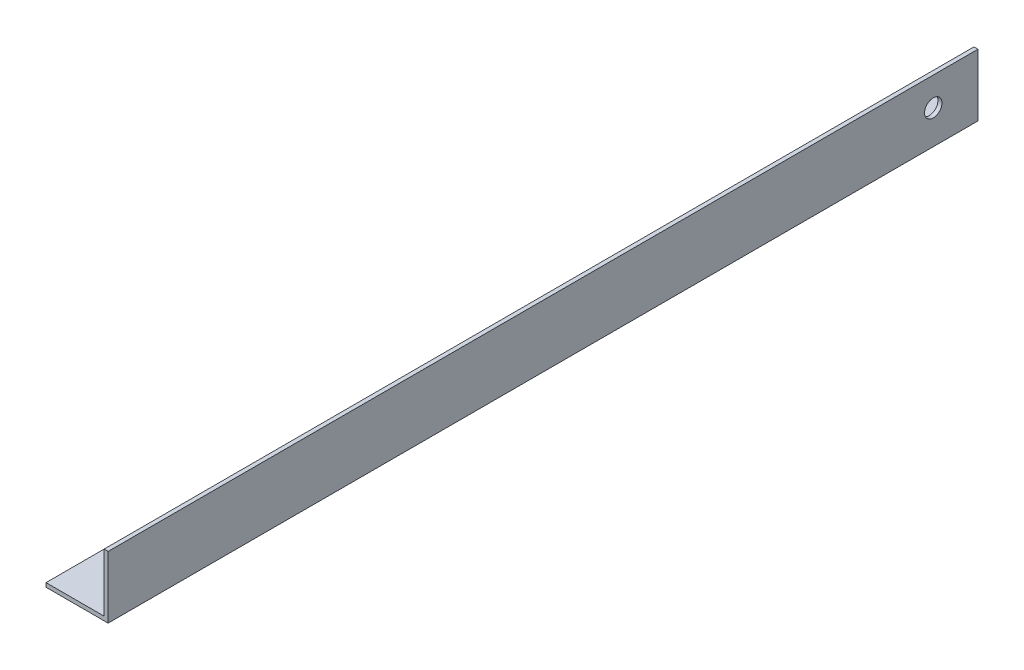
from build123d import *

# Parameters (mm, degrees)
SKETCH1_W           = 25.4
SKETCH1_H           = 25.4
BOSS_EXTRUDE1_DEPTH = 355.6
SKETCH3_W           = 26.173809645
SKETCH3_H           = 26.478044322
CUT_EXTRUDE2_DEPTH  = 355.6
SKETCH5_R           = 3.556
CUT_EXTRUDE3_DEPTH  = 358.409680899


with BuildPart() as part:
    # Sketch1 → Boss-Extrude1 (new body)
    with BuildSketch(Plane.XY):
        with Locations((-35.089575682, -12.7)):
            Rectangle(SKETCH1_W, SKETCH1_H)
    extrude(amount=BOSS_EXTRUDE1_DEPTH)

    # Sketch3 → Cut-Extrude2 (cut)
    with BuildSketch(Plane.XY.offset(355.6)):
        with Locations((-37.127480504, -10.509977839)):
            Rectangle(SKETCH3_W, SKETCH3_H)
    extrude(amount=-CUT_EXTRUDE2_DEPTH, mode=Mode.SUBTRACT)

    # Sketch5 → Cut-Extrude3 (cut, through all)
    with BuildSketch(Plane(origin=(-22.389575682, 0, 0), x_dir=(0, 0, -1), z_dir=(1, 0, 0))):
        with Locations(Location((-18.288, -11.648501303, 0), (0, 0, 90))):
            Circle(SKETCH5_R)
    extrude(amount=-CUT_EXTRUDE3_DEPTH, mode=Mode.SUBTRACT)


solid = part.part
